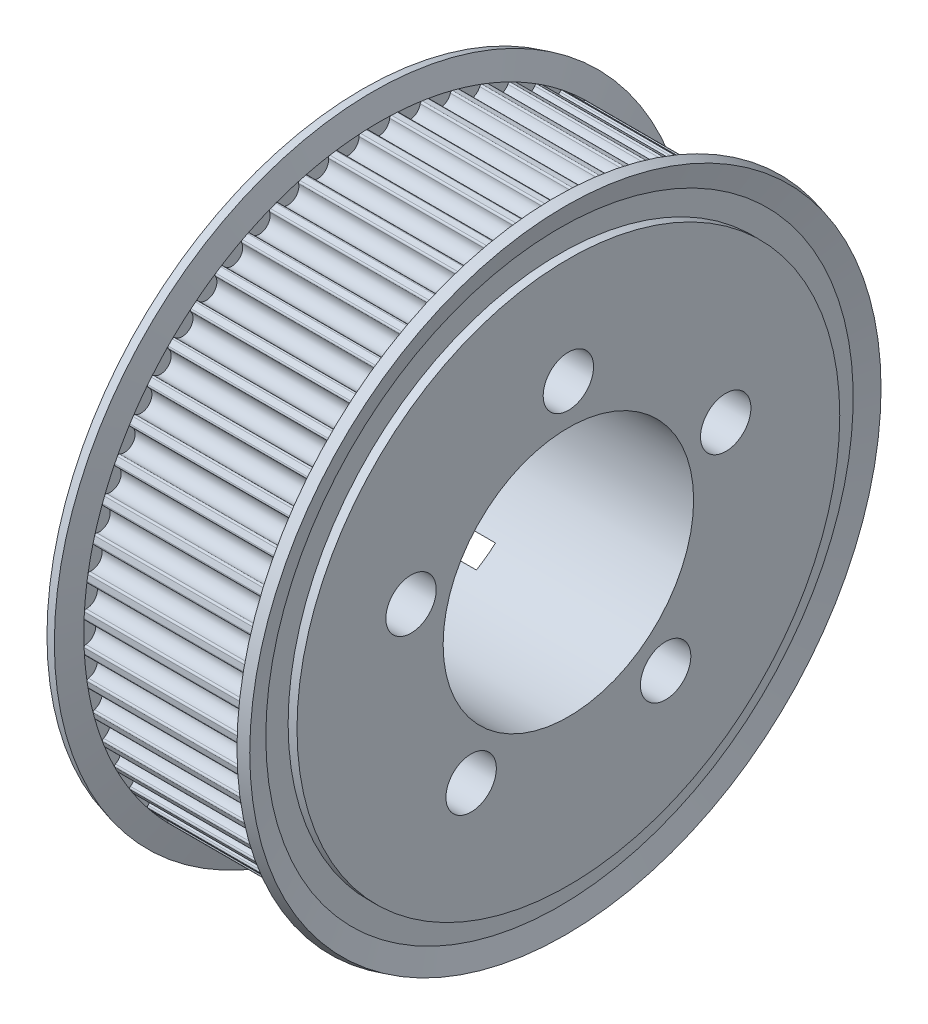
from build123d import *

# Parameters (mm, degrees)
CUT_EXTRUDE1_DEPTH       = 8.15
CUT_EXTRUDE1_DEPTH_BACK  = 8.15
CUT_EXTRUDE2_DEPTH       = 8.15
CUT_EXTRUDE2_DEPTH_BACK  = 8.15
CUT_EXTRUDE3_DEPTH       = 8.15
CUT_EXTRUDE3_DEPTH_BACK  = 8.15
CUT_EXTRUDE4_DEPTH       = 8.15
CUT_EXTRUDE4_DEPTH_BACK  = 8.15
CUT_EXTRUDE5_DEPTH       = 8.15
CUT_EXTRUDE5_DEPTH_BACK  = 8.15
CUT_EXTRUDE6_DEPTH       = 8.15
CUT_EXTRUDE6_DEPTH_BACK  = 8.15
CUT_EXTRUDE7_DEPTH       = 8.15
CUT_EXTRUDE7_DEPTH_BACK  = 8.15
CUT_EXTRUDE8_DEPTH       = 8.15
CUT_EXTRUDE8_DEPTH_BACK  = 8.15
CUT_EXTRUDE9_DEPTH       = 8.15
CUT_EXTRUDE9_DEPTH_BACK  = 8.15
CUT_EXTRUDE10_DEPTH      = 8.15
CUT_EXTRUDE10_DEPTH_BACK = 8.15
CUT_EXTRUDE11_DEPTH      = 8.15
CUT_EXTRUDE11_DEPTH_BACK = 8.15
CUT_EXTRUDE12_DEPTH      = 8.15
CUT_EXTRUDE12_DEPTH_BACK = 8.15
CUT_EXTRUDE13_DEPTH      = 8.15
CUT_EXTRUDE13_DEPTH_BACK = 8.15
CUT_EXTRUDE14_DEPTH      = 8.15
CUT_EXTRUDE14_DEPTH_BACK = 8.15
CUT_EXTRUDE15_DEPTH      = 8.15
CUT_EXTRUDE15_DEPTH_BACK = 8.15
CUT_EXTRUDE16_DEPTH      = 8.15
CUT_EXTRUDE16_DEPTH_BACK = 8.15
CUT_EXTRUDE17_DEPTH      = 8.15
CUT_EXTRUDE17_DEPTH_BACK = 8.15
CUT_EXTRUDE18_DEPTH      = 8.15
CUT_EXTRUDE18_DEPTH_BACK = 8.15
CUT_EXTRUDE19_DEPTH      = 8.15
CUT_EXTRUDE19_DEPTH_BACK = 8.15
CUT_EXTRUDE20_DEPTH      = 8.15
CUT_EXTRUDE20_DEPTH_BACK = 8.15
CUT_EXTRUDE21_DEPTH      = 8.15
CUT_EXTRUDE21_DEPTH_BACK = 8.15
CUT_EXTRUDE22_DEPTH      = 8.15
CUT_EXTRUDE22_DEPTH_BACK = 8.15
CUT_EXTRUDE23_DEPTH      = 8.15
CUT_EXTRUDE23_DEPTH_BACK = 8.15
CUT_EXTRUDE24_DEPTH      = 8.15
CUT_EXTRUDE24_DEPTH_BACK = 8.15
CUT_EXTRUDE25_DEPTH      = 8.15
CUT_EXTRUDE25_DEPTH_BACK = 8.15
CUT_EXTRUDE26_DEPTH      = 8.15
CUT_EXTRUDE26_DEPTH_BACK = 8.15
CUT_EXTRUDE27_DEPTH      = 8.15
CUT_EXTRUDE27_DEPTH_BACK = 8.15
CUT_EXTRUDE28_DEPTH      = 8.15
CUT_EXTRUDE28_DEPTH_BACK = 8.15
CUT_EXTRUDE29_DEPTH      = 8.15
CUT_EXTRUDE29_DEPTH_BACK = 8.15
CUT_EXTRUDE30_DEPTH      = 8.15
CUT_EXTRUDE30_DEPTH_BACK = 8.15
CUT_EXTRUDE31_DEPTH      = 8.15
CUT_EXTRUDE31_DEPTH_BACK = 8.15
CUT_EXTRUDE32_DEPTH      = 8.15
CUT_EXTRUDE32_DEPTH_BACK = 8.15
CUT_EXTRUDE33_DEPTH      = 8.15
CUT_EXTRUDE33_DEPTH_BACK = 8.15
CUT_EXTRUDE34_DEPTH      = 8.15
CUT_EXTRUDE34_DEPTH_BACK = 8.15
CUT_EXTRUDE35_DEPTH      = 8.15
CUT_EXTRUDE35_DEPTH_BACK = 8.15
CUT_EXTRUDE36_DEPTH      = 8.15
CUT_EXTRUDE36_DEPTH_BACK = 8.15
CUT_EXTRUDE37_DEPTH      = 8.15
CUT_EXTRUDE37_DEPTH_BACK = 8.15
CUT_EXTRUDE38_DEPTH      = 8.15
CUT_EXTRUDE38_DEPTH_BACK = 8.15
CUT_EXTRUDE39_DEPTH      = 8.15
CUT_EXTRUDE39_DEPTH_BACK = 8.15
CUT_EXTRUDE40_DEPTH      = 8.15
CUT_EXTRUDE40_DEPTH_BACK = 8.15
CUT_EXTRUDE41_DEPTH      = 8.15
CUT_EXTRUDE41_DEPTH_BACK = 8.15
CUT_EXTRUDE42_DEPTH      = 8.15
CUT_EXTRUDE42_DEPTH_BACK = 8.15
CUT_EXTRUDE43_DEPTH      = 8.15
CUT_EXTRUDE43_DEPTH_BACK = 8.15
CUT_EXTRUDE44_DEPTH      = 8.15
CUT_EXTRUDE44_DEPTH_BACK = 8.15
CUT_EXTRUDE45_DEPTH      = 8.15
CUT_EXTRUDE45_DEPTH_BACK = 8.15
CUT_EXTRUDE46_DEPTH      = 8.15
CUT_EXTRUDE46_DEPTH_BACK = 8.15
CUT_EXTRUDE47_DEPTH      = 8.15
CUT_EXTRUDE47_DEPTH_BACK = 8.15
CUT_EXTRUDE48_DEPTH      = 8.15
CUT_EXTRUDE48_DEPTH_BACK = 8.15
CUT_EXTRUDE49_DEPTH      = 8.15
CUT_EXTRUDE49_DEPTH_BACK = 8.15
CUT_EXTRUDE50_DEPTH      = 8.15
CUT_EXTRUDE50_DEPTH_BACK = 8.15
CUT_EXTRUDE51_DEPTH      = 8.15
CUT_EXTRUDE51_DEPTH_BACK = 8.15
CUT_EXTRUDE52_DEPTH      = 8.15
CUT_EXTRUDE52_DEPTH_BACK = 8.15
CUT_EXTRUDE53_DEPTH      = 8.15
CUT_EXTRUDE53_DEPTH_BACK = 8.15
CUT_EXTRUDE54_DEPTH      = 8.15
CUT_EXTRUDE54_DEPTH_BACK = 8.15
CUT_EXTRUDE55_DEPTH      = 8.15
CUT_EXTRUDE55_DEPTH_BACK = 8.15
CUT_EXTRUDE56_DEPTH      = 8.15
CUT_EXTRUDE56_DEPTH_BACK = 8.15
CUT_EXTRUDE57_DEPTH      = 8.15
CUT_EXTRUDE57_DEPTH_BACK = 8.15
CUT_EXTRUDE58_DEPTH      = 8.15
CUT_EXTRUDE58_DEPTH_BACK = 8.15
CUT_EXTRUDE59_DEPTH      = 8.15
CUT_EXTRUDE59_DEPTH_BACK = 8.15
CUT_EXTRUDE60_DEPTH      = 8.15
CUT_EXTRUDE60_DEPTH_BACK = 8.15
SKETCH62_W               = 20
SKETCH62_H               = 12
SKETCH63_R               = 2.413
CUT_EXTRUDE61_DEPTH      = 48.544715795
SKETCH64_R               = 4.064
CUT_EXTRUDE62_DEPTH      = 5.08


with BuildPart() as part:
    # Sketch1 → Revolve1 (revolve)
    with BuildSketch(Plane.XY, mode=Mode.PRIVATE) as revolve1_sk:
        Polygon((0, 0), (0, 26), (0.85, 26), (0.85, 28.138347502), (0.286547475, 30.241180955), (1.252473301, 30.5), (1.85, 28.27), (18.15, 28.27), (18.747526699, 30.5), (19.713452525, 30.241180955), (19.15, 28.138347502), (19.15, 26), (20, 26), (20, 0), align=None)
    revolve(revolve1_sk.sketch.rotate(Axis((20, 0, 0), (-1, 0, 0)), 270), axis=Axis((20, 0, 0), (-1, 0, 0)))

    # Sketch2 → Cut-Extrude1 (cut, two sides: drawn at the far end of the back side and taken through both)
    with BuildSketch(Plane(origin=(10, 0, 0), x_dir=(0, 0, -1), z_dir=(1, 0, 0)).offset(-CUT_EXTRUDE1_DEPTH_BACK)):
        with BuildLine():
            Line((-1.220377727, 28.623996545), (-1.204191216, 28.244341442))
            ThreePointArc((-1.204191216, 28.244341442), (-1.083780205, 28.201352445), (-1.027381979, 28.086608793))
            ThreePointArc((-1.027381979, 28.086608793), (5e-08, 27.13), (1.027381986, 28.086608894))
            ThreePointArc((1.027381986, 28.086608894), (1.083780242, 28.201352479), (1.204191216, 28.244341442))
            Line((1.204191216, 28.244341442), (1.220377727, 28.623996545))
            ThreePointArc((1.220377727, 28.623996545), (0, 28.65), (-1.220377727, 28.623996545))
        make_face()
    extrude(amount=CUT_EXTRUDE1_DEPTH + CUT_EXTRUDE1_DEPTH_BACK, mode=Mode.SUBTRACT)

    # Sketch3 → Cut-Extrude2 (cut, two sides: drawn at the far end of the back side and taken through both)
    with BuildSketch(Plane(origin=(10, 0, 0), x_dir=(0, 0, -1), z_dir=(1, 0, 0)).offset(-CUT_EXTRUDE2_DEPTH_BACK)):
        with BuildLine():
            Line((-4.205714742, 28.339627088), (-4.149932138, 27.963743727))
            ThreePointArc((-4.149932138, 27.963743727), (-4.025687177, 27.933576607), (-3.957603929, 27.825356752))
            ThreePointArc((-3.957603929, 27.825356752), (-2.835857158, 26.981379027), (-1.914096186, 28.040138172))
            ThreePointArc((-1.914096186, 28.040138172), (-1.870000856, 28.160148403), (-1.754743076, 28.215488242))
            Line((-1.754743076, 28.215488242), (-1.778330001, 28.594755505))
            ThreePointArc((-1.778330001, 28.594755505), (-2.994740473, 28.493052302), (-4.205714742, 28.339627088))
        make_face()
    extrude(amount=CUT_EXTRUDE2_DEPTH + CUT_EXTRUDE2_DEPTH_BACK, mode=Mode.SUBTRACT)

    # Sketch4 → Cut-Extrude3 (cut, two sides: drawn at the far end of the back side and taken through both)
    with BuildSketch(Plane(origin=(10, 0, 0), x_dir=(0, 0, -1), z_dir=(1, 0, 0)).offset(-CUT_EXTRUDE3_DEPTH_BACK)):
        with BuildLine():
            Line((-7.144973065, 27.744762747), (-7.050205534, 27.376769384))
            ThreePointArc((-7.050205534, 27.376769384), (-6.923487877, 27.359754657), (-6.844465541, 27.25924428))
            ThreePointArc((-6.844465541, 27.25924428), (-5.640644123, 26.537144418), (-4.83460312, 27.686453828))
            ThreePointArc((-4.83460312, 27.686453828), (-4.803293833, 27.810415847), (-4.694452036, 27.877500248))
            Line((-4.694452036, 27.877500248), (-4.757553974, 28.252224341))
            ThreePointArc((-4.757553974, 28.252224341), (-5.956669942, 28.023928761), (-7.144973065, 27.744762747))
        make_face()
    extrude(amount=CUT_EXTRUDE3_DEPTH + CUT_EXTRUDE3_DEPTH_BACK, mode=Mode.SUBTRACT)

    # Sketch5 → Cut-Extrude4 (cut, two sides: drawn at the far end of the back side and taken through both)
    with BuildSketch(Plane(origin=(10, 0, 0), x_dir=(0, 0, -1), z_dir=(1, 0, 0)).offset(-CUT_EXTRUDE4_DEPTH_BACK)):
        with BuildLine():
            Line((-10.005949569, 26.845920979), (-9.873235404, 26.489849427))
            ThreePointArc((-9.873235404, 26.489849427), (-9.745433396, 26.48617351), (-9.656337757, 26.394473822))
            ThreePointArc((-9.656337757, 26.394473822), (-8.383631009, 25.802163303), (-7.70214113, 27.029430903))
            ThreePointArc((-7.70214113, 27.029430903), (-7.683960919, 27.155986556), (-7.582727597, 27.234080528))
            Line((-7.582727597, 27.234080528), (-7.68465319, 27.600155894))
            ThreePointArc((-7.68465319, 27.600155894), (-8.853336889, 27.247769192), (-10.005949569, 26.845920979))
        make_face()
    extrude(amount=CUT_EXTRUDE4_DEPTH + CUT_EXTRUDE4_DEPTH_BACK, mode=Mode.SUBTRACT)

    # Sketch6 → Cut-Extrude5 (cut, two sides: drawn at the far end of the back side and taken through both)
    with BuildSketch(Plane(origin=(10, 0, 0), x_dir=(0, 0, -1), z_dir=(1, 0, 0)).offset(-CUT_EXTRUDE5_DEPTH_BACK)):
        with BuildLine():
            Line((-12.757298795, 25.652949683), (-12.58809204, 25.312701136))
            ThreePointArc((-12.58809204, 25.312701136), (-12.460605907, 25.322404304), (-12.362413116, 25.240519986))
            ThreePointArc((-12.362413116, 25.240519986), (-11.034765081, 24.784488286), (-10.48529287, 26.076267876))
            ThreePointArc((-10.48529287, 26.076267876), (-10.48044092, 26.204030594), (-10.387925208, 26.292278522))
            Line((-10.387925208, 26.292278522), (-10.527557737, 26.645694363))
            ThreePointArc((-10.527557737, 26.645694363), (-11.653004824, 26.173077361), (-12.757298795, 25.652949683))
        make_face()
    extrude(amount=CUT_EXTRUDE5_DEPTH + CUT_EXTRUDE5_DEPTH_BACK, mode=Mode.SUBTRACT)

    # Sketch7 → Cut-Extrude6 (cut, two sides: drawn at the far end of the back side and taken through both)
    with BuildSketch(Plane(origin=(10, 0, 0), x_dir=(0, 0, -1), z_dir=(1, 0, 0)).offset(-CUT_EXTRUDE6_DEPTH_BACK)):
        with BuildLine():
            Line((-15.368876386, 24.178919302), (-15.165030906, 23.858221594))
            ThreePointArc((-15.165030906, 23.858221594), (-15.039257412, 23.881197536), (-14.93304329, 23.810025732))
            ThreePointArc((-14.93304329, 23.810025732), (-13.564999956, 23.49526923), (-13.153565547, 24.837407801))
            ThreePointArc((-13.153565547, 24.837407801), (-13.162095017, 24.964977789), (-13.079310537, 25.06241281))
            Line((-13.079310537, 25.06241281), (-13.255120158, 25.399297029))
            ThreePointArc((-13.255120158, 25.399297029), (-14.325, 24.811627818), (-15.368876386, 24.178919302))
        make_face()
    extrude(amount=CUT_EXTRUDE6_DEPTH + CUT_EXTRUDE6_DEPTH_BACK, mode=Mode.SUBTRACT)

    # Sketch8 → Cut-Extrude7 (cut, two sides: drawn at the far end of the back side and taken through both)
    with BuildSketch(Plane(origin=(10, 0, 0), x_dir=(0, 0, -1), z_dir=(1, 0, 0)).offset(-CUT_EXTRUDE7_DEPTH_BACK)):
        with BuildLine():
            Line((-17.812069352, 22.439979621), (-17.575818519, 22.142346384))
            ThreePointArc((-17.575818519, 22.142346384), (-17.453135666, 22.178343372), (-17.340063916, 22.118663852))
            ThreePointArc((-17.340063916, 22.118663852), (-15.946613854, 21.948631087), (-15.677725008, 23.326423889))
            ThreePointArc((-15.677725008, 23.326423889), (-15.699542448, 23.452403463), (-15.627396202, 23.55795806))
            Line((-15.627396202, 23.55795806), (-15.83745671, 23.874619682))
            ThreePointArc((-15.83745671, 23.874619682), (-16.840047478, 23.178336889), (-17.812069352, 22.439979621))
        make_face()
    extrude(amount=CUT_EXTRUDE7_DEPTH + CUT_EXTRUDE7_DEPTH_BACK, mode=Mode.SUBTRACT)

    # Sketch9 → Cut-Extrude8 (cut, two sides: drawn at the far end of the back side and taken through both)
    with BuildSketch(Plane(origin=(10, 0, 0), x_dir=(0, 0, -1), z_dir=(1, 0, 0)).offset(-CUT_EXTRUDE8_DEPTH_BACK)):
        with BuildLine():
            Line((-20.060109558, 20.455182828), (-19.794041787, 20.183874993))
            ThreePointArc((-19.794041787, 20.183874993), (-19.675793713, 20.232498636), (-19.557103174, 20.184965263))
            ThreePointArc((-19.557103174, 20.184965263), (-18.153513313, 20.161519149), (-18.030116033, 21.559870796))
            ThreePointArc((-18.030116033, 21.559870796), (-18.064982405, 21.682879697), (-18.004264844, 21.795397391))
            Line((-18.004264844, 21.795397391), (-18.246274771, 22.088367005))
            ThreePointArc((-18.246274771, 22.088367005), (-19.170591872, 21.29109925), (-20.060109558, 20.455182828))
        make_face()
    extrude(amount=CUT_EXTRUDE8_DEPTH + CUT_EXTRUDE8_DEPTH_BACK, mode=Mode.SUBTRACT)

    # Sketch10 → Cut-Extrude9 (cut, two sides: drawn at the far end of the back side and taken through both)
    with BuildSketch(Plane(origin=(10, 0, 0), x_dir=(0, 0, -1), z_dir=(1, 0, 0)).offset(-CUT_EXTRUDE9_DEPTH_BACK)):
        with BuildLine():
            Line((-22.088367005, 18.246274771), (-21.795397391, 18.004264844))
            ThreePointArc((-21.795397391, 18.004264844), (-21.682879647, 18.064982411), (-21.559870717, 18.030115971))
            ThreePointArc((-21.559870717, 18.030115971), (-20.161519081, 18.153513388), (-20.184965333, 19.557103247))
            ThreePointArc((-20.184965333, 19.557103247), (-20.232498635, 19.675793763), (-20.183874993, 19.794041787))
            Line((-20.183874993, 19.794041787), (-20.455182828, 20.060109558))
            ThreePointArc((-20.455182828, 20.060109558), (-21.29109925, 19.170591872), (-22.088367005, 18.246274771))
        make_face()
    extrude(amount=CUT_EXTRUDE9_DEPTH + CUT_EXTRUDE9_DEPTH_BACK, mode=Mode.SUBTRACT)

    # Sketch11 → Cut-Extrude10 (cut, two sides: drawn at the far end of the back side and taken through both)
    with BuildSketch(Plane(origin=(10, 0, 0), x_dir=(0, 0, -1), z_dir=(1, 0, 0)).offset(-CUT_EXTRUDE10_DEPTH_BACK)):
        with BuildLine():
            Line((-23.874619682, 15.83745671), (-23.55795806, 15.627396202))
            ThreePointArc((-23.55795806, 15.627396202), (-23.452403414, 15.699542458), (-23.326423804, 15.677724955))
            ThreePointArc((-23.326423804, 15.677724955), (-21.948631028, 15.946613935), (-22.11866393, 17.340063981))
            ThreePointArc((-22.11866393, 17.340063981), (-22.178343377, 17.453135716), (-22.142346384, 17.575818519))
            Line((-22.142346384, 17.575818519), (-22.439979621, 17.812069352))
            ThreePointArc((-22.439979621, 17.812069352), (-23.178336889, 16.840047478), (-23.874619682, 15.83745671))
        make_face()
    extrude(amount=CUT_EXTRUDE10_DEPTH + CUT_EXTRUDE10_DEPTH_BACK, mode=Mode.SUBTRACT)

    # Sketch12 → Cut-Extrude11 (cut, two sides: drawn at the far end of the back side and taken through both)
    with BuildSketch(Plane(origin=(10, 0, 0), x_dir=(0, 0, -1), z_dir=(1, 0, 0)).offset(-CUT_EXTRUDE11_DEPTH_BACK)):
        with BuildLine():
            Line((-25.399297029, 13.255120158), (-25.06241281, 13.079310537))
            ThreePointArc((-25.06241281, 13.079310537), (-24.964977741, 13.162095033), (-24.837407711, 13.153565503))
            ThreePointArc((-24.837407711, 13.153565503), (-23.495269179, 13.565000044), (-23.810025815, 14.933043346))
            ThreePointArc((-23.810025815, 14.933043346), (-23.881197547, 15.039257461), (-23.858221594, 15.165030906))
            Line((-23.858221594, 15.165030906), (-24.178919302, 15.368876386))
            ThreePointArc((-24.178919302, 15.368876386), (-24.811627818, 14.325), (-25.399297029, 13.255120158))
        make_face()
    extrude(amount=CUT_EXTRUDE11_DEPTH + CUT_EXTRUDE11_DEPTH_BACK, mode=Mode.SUBTRACT)

    # Sketch13 → Cut-Extrude12 (cut, two sides: drawn at the far end of the back side and taken through both)
    with BuildSketch(Plane(origin=(10, 0, 0), x_dir=(0, 0, -1), z_dir=(1, 0, 0)).offset(-CUT_EXTRUDE12_DEPTH_BACK)):
        with BuildLine():
            Line((-26.645694363, 10.527557737), (-26.292278522, 10.387925208))
            ThreePointArc((-26.292278522, 10.387925208), (-26.204030548, 10.480440941), (-26.076267781, 10.485292836))
            ThreePointArc((-26.076267781, 10.485292836), (-24.784488245, 11.034765173), (-25.240520075, 12.362413164))
            ThreePointArc((-25.240520075, 12.362413164), (-25.322404319, 12.460605955), (-25.312701136, 12.58809204))
            Line((-25.312701136, 12.58809204), (-25.652949683, 12.757298795))
            ThreePointArc((-25.652949683, 12.757298795), (-26.173077361, 11.653004824), (-26.645694363, 10.527557737))
        make_face()
    extrude(amount=CUT_EXTRUDE12_DEPTH + CUT_EXTRUDE12_DEPTH_BACK, mode=Mode.SUBTRACT)

    # Sketch14 → Cut-Extrude13 (cut, two sides: drawn at the far end of the back side and taken through both)
    with BuildSketch(Plane(origin=(10, 0, 0), x_dir=(0, 0, -1), z_dir=(1, 0, 0)).offset(-CUT_EXTRUDE13_DEPTH_BACK)):
        with BuildLine():
            Line((-27.600155894, 7.68465319), (-27.234080528, 7.582727597))
            ThreePointArc((-27.234080528, 7.582727597), (-27.155986513, 7.683960944), (-27.029430805, 7.702141106))
            ThreePointArc((-27.029430805, 7.702141106), (-25.802163272, 8.383631105), (-26.394473916, 9.656337795))
            ThreePointArc((-26.394473916, 9.656337795), (-26.48617353, 9.745433442), (-26.489849427, 9.873235404))
            Line((-26.489849427, 9.873235404), (-26.845920979, 10.005949569))
            ThreePointArc((-26.845920979, 10.005949569), (-27.247769192, 8.853336889), (-27.600155894, 7.68465319))
        make_face()
    extrude(amount=CUT_EXTRUDE13_DEPTH + CUT_EXTRUDE13_DEPTH_BACK, mode=Mode.SUBTRACT)

    # Sketch15 → Cut-Extrude14 (cut, two sides: drawn at the far end of the back side and taken through both)
    with BuildSketch(Plane(origin=(10, 0, 0), x_dir=(0, 0, -1), z_dir=(1, 0, 0)).offset(-CUT_EXTRUDE14_DEPTH_BACK)):
        with BuildLine():
            Line((-28.252224341, 4.757553974), (-27.877500248, 4.694452036))
            ThreePointArc((-27.877500248, 4.694452036), (-27.810415807, 4.803293863), (-27.686453728, 4.834603106))
            ThreePointArc((-27.686453728, 4.834603106), (-26.537144397, 5.640644221), (-27.259244376, 6.844465569))
            ThreePointArc((-27.259244376, 6.844465569), (-27.359754682, 6.923487921), (-27.376769384, 7.050205534))
            Line((-27.376769384, 7.050205534), (-27.744762747, 7.144973065))
            ThreePointArc((-27.744762747, 7.144973065), (-28.023928761, 5.956669942), (-28.252224341, 4.757553974))
        make_face()
    extrude(amount=CUT_EXTRUDE14_DEPTH + CUT_EXTRUDE14_DEPTH_BACK, mode=Mode.SUBTRACT)

    # Sketch16 → Cut-Extrude15 (cut, two sides: drawn at the far end of the back side and taken through both)
    with BuildSketch(Plane(origin=(10, 0, 0), x_dir=(0, 0, -1), z_dir=(1, 0, 0)).offset(-CUT_EXTRUDE15_DEPTH_BACK)):
        with BuildLine():
            Line((-28.594755505, 1.778330001), (-28.215488242, 1.754743076))
            ThreePointArc((-28.215488242, 1.754743076), (-28.160148365, 1.87000089), (-28.040138071, 1.914096183))
            ThreePointArc((-28.040138071, 1.914096183), (-26.981379016, 2.835857259), (-27.825356851, 3.957603946))
            ThreePointArc((-27.825356851, 3.957603946), (-27.933576636, 4.025687218), (-27.963743727, 4.149932138))
            Line((-27.963743727, 4.149932138), (-28.339627088, 4.205714742))
            ThreePointArc((-28.339627088, 4.205714742), (-28.493052302, 2.994740473), (-28.594755505, 1.778330001))
        make_face()
    extrude(amount=CUT_EXTRUDE15_DEPTH + CUT_EXTRUDE15_DEPTH_BACK, mode=Mode.SUBTRACT)

    # Sketch17 → Cut-Extrude16 (cut, two sides: drawn at the far end of the back side and taken through both)
    with BuildSketch(Plane(origin=(10, 0, 0), x_dir=(0, 0, -1), z_dir=(1, 0, 0)).offset(-CUT_EXTRUDE16_DEPTH_BACK)):
        with BuildLine():
            Line((-28.623996545, -1.220377727), (-28.244341442, -1.204191216))
            ThreePointArc((-28.244341442, -1.204191216), (-28.201352445, -1.083780205), (-28.086608793, -1.027381979))
            ThreePointArc((-28.086608793, -1.027381979), (-27.13, 5e-08), (-28.086608894, 1.027381986))
            ThreePointArc((-28.086608894, 1.027381986), (-28.201352479, 1.083780242), (-28.244341442, 1.204191216))
            Line((-28.244341442, 1.204191216), (-28.623996545, 1.220377727))
            ThreePointArc((-28.623996545, 1.220377727), (-28.65, 0), (-28.623996545, -1.220377727))
        make_face()
    extrude(amount=CUT_EXTRUDE16_DEPTH + CUT_EXTRUDE16_DEPTH_BACK, mode=Mode.SUBTRACT)

    # Sketch18 → Cut-Extrude17 (cut, two sides: drawn at the far end of the back side and taken through both)
    with BuildSketch(Plane(origin=(10, 0, 0), x_dir=(0, 0, -1), z_dir=(1, 0, 0)).offset(-CUT_EXTRUDE17_DEPTH_BACK)):
        with BuildLine():
            Line((-28.339627088, -4.205714742), (-27.963743727, -4.149932138))
            ThreePointArc((-27.963743727, -4.149932138), (-27.933576607, -4.025687177), (-27.825356752, -3.957603929))
            ThreePointArc((-27.825356752, -3.957603929), (-26.981379027, -2.835857158), (-28.040138172, -1.914096186))
            ThreePointArc((-28.040138172, -1.914096186), (-28.160148403, -1.870000856), (-28.215488242, -1.754743076))
            Line((-28.215488242, -1.754743076), (-28.594755505, -1.778330001))
            ThreePointArc((-28.594755505, -1.778330001), (-28.493052302, -2.994740473), (-28.339627088, -4.205714742))
        make_face()
    extrude(amount=CUT_EXTRUDE17_DEPTH + CUT_EXTRUDE17_DEPTH_BACK, mode=Mode.SUBTRACT)

    # Sketch19 → Cut-Extrude18 (cut, two sides: drawn at the far end of the back side and taken through both)
    with BuildSketch(Plane(origin=(10, 0, 0), x_dir=(0, 0, -1), z_dir=(1, 0, 0)).offset(-CUT_EXTRUDE18_DEPTH_BACK)):
        with BuildLine():
            Line((-27.744762747, -7.144973065), (-27.376769384, -7.050205534))
            ThreePointArc((-27.376769384, -7.050205534), (-27.359754657, -6.923487877), (-27.25924428, -6.844465541))
            ThreePointArc((-27.25924428, -6.844465541), (-26.537144418, -5.640644123), (-27.686453828, -4.83460312))
            ThreePointArc((-27.686453828, -4.83460312), (-27.810415847, -4.803293833), (-27.877500248, -4.694452036))
            Line((-27.877500248, -4.694452036), (-28.252224341, -4.757553974))
            ThreePointArc((-28.252224341, -4.757553974), (-28.023928761, -5.956669942), (-27.744762747, -7.144973065))
        make_face()
    extrude(amount=CUT_EXTRUDE18_DEPTH + CUT_EXTRUDE18_DEPTH_BACK, mode=Mode.SUBTRACT)

    # Sketch20 → Cut-Extrude19 (cut, two sides: drawn at the far end of the back side and taken through both)
    with BuildSketch(Plane(origin=(10, 0, 0), x_dir=(0, 0, -1), z_dir=(1, 0, 0)).offset(-CUT_EXTRUDE19_DEPTH_BACK)):
        with BuildLine():
            Line((-26.845920979, -10.005949569), (-26.489849427, -9.873235404))
            ThreePointArc((-26.489849427, -9.873235404), (-26.48617351, -9.745433396), (-26.394473822, -9.656337757))
            ThreePointArc((-26.394473822, -9.656337757), (-25.802163303, -8.383631009), (-27.029430903, -7.70214113))
            ThreePointArc((-27.029430903, -7.70214113), (-27.155986556, -7.683960919), (-27.234080528, -7.582727597))
            Line((-27.234080528, -7.582727597), (-27.600155894, -7.68465319))
            ThreePointArc((-27.600155894, -7.68465319), (-27.247769192, -8.853336889), (-26.845920979, -10.005949569))
        make_face()
    extrude(amount=CUT_EXTRUDE19_DEPTH + CUT_EXTRUDE19_DEPTH_BACK, mode=Mode.SUBTRACT)

    # Sketch21 → Cut-Extrude20 (cut, two sides: drawn at the far end of the back side and taken through both)
    with BuildSketch(Plane(origin=(10, 0, 0), x_dir=(0, 0, -1), z_dir=(1, 0, 0)).offset(-CUT_EXTRUDE20_DEPTH_BACK)):
        with BuildLine():
            Line((-25.652949683, -12.757298795), (-25.312701136, -12.58809204))
            ThreePointArc((-25.312701136, -12.58809204), (-25.322404304, -12.460605907), (-25.240519986, -12.362413116))
            ThreePointArc((-25.240519986, -12.362413116), (-24.784488286, -11.034765081), (-26.076267876, -10.48529287))
            ThreePointArc((-26.076267876, -10.48529287), (-26.204030594, -10.48044092), (-26.292278522, -10.387925208))
            Line((-26.292278522, -10.387925208), (-26.645694363, -10.527557737))
            ThreePointArc((-26.645694363, -10.527557737), (-26.173077361, -11.653004824), (-25.652949683, -12.757298795))
        make_face()
    extrude(amount=CUT_EXTRUDE20_DEPTH + CUT_EXTRUDE20_DEPTH_BACK, mode=Mode.SUBTRACT)

    # Sketch22 → Cut-Extrude21 (cut, two sides: drawn at the far end of the back side and taken through both)
    with BuildSketch(Plane(origin=(10, 0, 0), x_dir=(0, 0, -1), z_dir=(1, 0, 0)).offset(-CUT_EXTRUDE21_DEPTH_BACK)):
        with BuildLine():
            Line((-24.178919302, -15.368876386), (-23.858221594, -15.165030906))
            ThreePointArc((-23.858221594, -15.165030906), (-23.881197536, -15.039257412), (-23.810025732, -14.93304329))
            ThreePointArc((-23.810025732, -14.93304329), (-23.49526923, -13.564999956), (-24.837407801, -13.153565547))
            ThreePointArc((-24.837407801, -13.153565547), (-24.964977789, -13.162095017), (-25.06241281, -13.079310537))
            Line((-25.06241281, -13.079310537), (-25.399297029, -13.255120158))
            ThreePointArc((-25.399297029, -13.255120158), (-24.811627818, -14.325), (-24.178919302, -15.368876386))
        make_face()
    extrude(amount=CUT_EXTRUDE21_DEPTH + CUT_EXTRUDE21_DEPTH_BACK, mode=Mode.SUBTRACT)

    # Sketch23 → Cut-Extrude22 (cut, two sides: drawn at the far end of the back side and taken through both)
    with BuildSketch(Plane(origin=(10, 0, 0), x_dir=(0, 0, -1), z_dir=(1, 0, 0)).offset(-CUT_EXTRUDE22_DEPTH_BACK)):
        with BuildLine():
            Line((-22.439979621, -17.812069352), (-22.142346384, -17.575818519))
            ThreePointArc((-22.142346384, -17.575818519), (-22.178343372, -17.453135666), (-22.118663852, -17.340063916))
            ThreePointArc((-22.118663852, -17.340063916), (-21.948631087, -15.946613854), (-23.326423889, -15.677725008))
            ThreePointArc((-23.326423889, -15.677725008), (-23.452403463, -15.699542448), (-23.55795806, -15.627396202))
            Line((-23.55795806, -15.627396202), (-23.874619682, -15.83745671))
            ThreePointArc((-23.874619682, -15.83745671), (-23.178336889, -16.840047478), (-22.439979621, -17.812069352))
        make_face()
    extrude(amount=CUT_EXTRUDE22_DEPTH + CUT_EXTRUDE22_DEPTH_BACK, mode=Mode.SUBTRACT)

    # Sketch24 → Cut-Extrude23 (cut, two sides: drawn at the far end of the back side and taken through both)
    with BuildSketch(Plane(origin=(10, 0, 0), x_dir=(0, 0, -1), z_dir=(1, 0, 0)).offset(-CUT_EXTRUDE23_DEPTH_BACK)):
        with BuildLine():
            Line((-20.455182828, -20.060109558), (-20.183874993, -19.794041787))
            ThreePointArc((-20.183874993, -19.794041787), (-20.232498636, -19.675793713), (-20.184965263, -19.557103174))
            ThreePointArc((-20.184965263, -19.557103174), (-20.161519149, -18.153513313), (-21.559870796, -18.030116033))
            ThreePointArc((-21.559870796, -18.030116033), (-21.682879697, -18.064982405), (-21.795397391, -18.004264844))
            Line((-21.795397391, -18.004264844), (-22.088367005, -18.246274771))
            ThreePointArc((-22.088367005, -18.246274771), (-21.29109925, -19.170591872), (-20.455182828, -20.060109558))
        make_face()
    extrude(amount=CUT_EXTRUDE23_DEPTH + CUT_EXTRUDE23_DEPTH_BACK, mode=Mode.SUBTRACT)

    # Sketch25 → Cut-Extrude24 (cut, two sides: drawn at the far end of the back side and taken through both)
    with BuildSketch(Plane(origin=(10, 0, 0), x_dir=(0, 0, -1), z_dir=(1, 0, 0)).offset(-CUT_EXTRUDE24_DEPTH_BACK)):
        with BuildLine():
            Line((-18.246274771, -22.088367005), (-18.004264844, -21.795397391))
            ThreePointArc((-18.004264844, -21.795397391), (-18.064982411, -21.682879647), (-18.030115971, -21.559870717))
            ThreePointArc((-18.030115971, -21.559870717), (-18.153513388, -20.161519081), (-19.557103247, -20.184965333))
            ThreePointArc((-19.557103247, -20.184965333), (-19.675793763, -20.232498635), (-19.794041787, -20.183874993))
            Line((-19.794041787, -20.183874993), (-20.060109558, -20.455182828))
            ThreePointArc((-20.060109558, -20.455182828), (-19.170591872, -21.29109925), (-18.246274771, -22.088367005))
        make_face()
    extrude(amount=CUT_EXTRUDE24_DEPTH + CUT_EXTRUDE24_DEPTH_BACK, mode=Mode.SUBTRACT)

    # Sketch26 → Cut-Extrude25 (cut, two sides: drawn at the far end of the back side and taken through both)
    with BuildSketch(Plane(origin=(10, 0, 0), x_dir=(0, 0, -1), z_dir=(1, 0, 0)).offset(-CUT_EXTRUDE25_DEPTH_BACK)):
        with BuildLine():
            Line((-15.83745671, -23.874619682), (-15.627396202, -23.55795806))
            ThreePointArc((-15.627396202, -23.55795806), (-15.699542458, -23.452403414), (-15.677724955, -23.326423804))
            ThreePointArc((-15.677724955, -23.326423804), (-15.946613935, -21.948631028), (-17.340063981, -22.11866393))
            ThreePointArc((-17.340063981, -22.11866393), (-17.453135716, -22.178343377), (-17.575818519, -22.142346384))
            Line((-17.575818519, -22.142346384), (-17.812069352, -22.439979621))
            ThreePointArc((-17.812069352, -22.439979621), (-16.840047478, -23.178336889), (-15.83745671, -23.874619682))
        make_face()
    extrude(amount=CUT_EXTRUDE25_DEPTH + CUT_EXTRUDE25_DEPTH_BACK, mode=Mode.SUBTRACT)

    # Sketch27 → Cut-Extrude26 (cut, two sides: drawn at the far end of the back side and taken through both)
    with BuildSketch(Plane(origin=(10, 0, 0), x_dir=(0, 0, -1), z_dir=(1, 0, 0)).offset(-CUT_EXTRUDE26_DEPTH_BACK)):
        with BuildLine():
            Line((-13.255120158, -25.399297029), (-13.079310537, -25.06241281))
            ThreePointArc((-13.079310537, -25.06241281), (-13.162095033, -24.964977741), (-13.153565503, -24.837407711))
            ThreePointArc((-13.153565503, -24.837407711), (-13.565000044, -23.495269179), (-14.933043346, -23.810025815))
            ThreePointArc((-14.933043346, -23.810025815), (-15.039257461, -23.881197547), (-15.165030906, -23.858221594))
            Line((-15.165030906, -23.858221594), (-15.368876386, -24.178919302))
            ThreePointArc((-15.368876386, -24.178919302), (-14.325, -24.811627818), (-13.255120158, -25.399297029))
        make_face()
    extrude(amount=CUT_EXTRUDE26_DEPTH + CUT_EXTRUDE26_DEPTH_BACK, mode=Mode.SUBTRACT)

    # Sketch28 → Cut-Extrude27 (cut, two sides: drawn at the far end of the back side and taken through both)
    with BuildSketch(Plane(origin=(10, 0, 0), x_dir=(0, 0, -1), z_dir=(1, 0, 0)).offset(-CUT_EXTRUDE27_DEPTH_BACK)):
        with BuildLine():
            Line((-10.527557737, -26.645694363), (-10.387925208, -26.292278522))
            ThreePointArc((-10.387925208, -26.292278522), (-10.480440941, -26.204030548), (-10.485292836, -26.076267781))
            ThreePointArc((-10.485292836, -26.076267781), (-11.034765173, -24.784488245), (-12.362413164, -25.240520075))
            ThreePointArc((-12.362413164, -25.240520075), (-12.460605955, -25.322404319), (-12.58809204, -25.312701136))
            Line((-12.58809204, -25.312701136), (-12.757298795, -25.652949683))
            ThreePointArc((-12.757298795, -25.652949683), (-11.653004824, -26.173077361), (-10.527557737, -26.645694363))
        make_face()
    extrude(amount=CUT_EXTRUDE27_DEPTH + CUT_EXTRUDE27_DEPTH_BACK, mode=Mode.SUBTRACT)

    # Sketch29 → Cut-Extrude28 (cut, two sides: drawn at the far end of the back side and taken through both)
    with BuildSketch(Plane(origin=(10, 0, 0), x_dir=(0, 0, -1), z_dir=(1, 0, 0)).offset(-CUT_EXTRUDE28_DEPTH_BACK)):
        with BuildLine():
            Line((-7.68465319, -27.600155894), (-7.582727597, -27.234080528))
            ThreePointArc((-7.582727597, -27.234080528), (-7.683960944, -27.155986513), (-7.702141106, -27.029430805))
            ThreePointArc((-7.702141106, -27.029430805), (-8.383631105, -25.802163272), (-9.656337795, -26.394473916))
            ThreePointArc((-9.656337795, -26.394473916), (-9.745433442, -26.48617353), (-9.873235404, -26.489849427))
            Line((-9.873235404, -26.489849427), (-10.005949569, -26.845920979))
            ThreePointArc((-10.005949569, -26.845920979), (-8.853336889, -27.247769192), (-7.68465319, -27.600155894))
        make_face()
    extrude(amount=CUT_EXTRUDE28_DEPTH + CUT_EXTRUDE28_DEPTH_BACK, mode=Mode.SUBTRACT)

    # Sketch30 → Cut-Extrude29 (cut, two sides: drawn at the far end of the back side and taken through both)
    with BuildSketch(Plane(origin=(10, 0, 0), x_dir=(0, 0, -1), z_dir=(1, 0, 0)).offset(-CUT_EXTRUDE29_DEPTH_BACK)):
        with BuildLine():
            Line((-4.757553974, -28.252224341), (-4.694452036, -27.877500248))
            ThreePointArc((-4.694452036, -27.877500248), (-4.803293863, -27.810415807), (-4.834603106, -27.686453728))
            ThreePointArc((-4.834603106, -27.686453728), (-5.640644221, -26.537144397), (-6.844465569, -27.259244376))
            ThreePointArc((-6.844465569, -27.259244376), (-6.923487921, -27.359754682), (-7.050205534, -27.376769384))
            Line((-7.050205534, -27.376769384), (-7.144973065, -27.744762747))
            ThreePointArc((-7.144973065, -27.744762747), (-5.956669942, -28.023928761), (-4.757553974, -28.252224341))
        make_face()
    extrude(amount=CUT_EXTRUDE29_DEPTH + CUT_EXTRUDE29_DEPTH_BACK, mode=Mode.SUBTRACT)

    # Sketch31 → Cut-Extrude30 (cut, two sides: drawn at the far end of the back side and taken through both)
    with BuildSketch(Plane(origin=(10, 0, 0), x_dir=(0, 0, -1), z_dir=(1, 0, 0)).offset(-CUT_EXTRUDE30_DEPTH_BACK)):
        with BuildLine():
            Line((-1.778330001, -28.594755505), (-1.754743076, -28.215488242))
            ThreePointArc((-1.754743076, -28.215488242), (-1.87000089, -28.160148365), (-1.914096183, -28.040138071))
            ThreePointArc((-1.914096183, -28.040138071), (-2.835857259, -26.981379016), (-3.957603946, -27.825356851))
            ThreePointArc((-3.957603946, -27.825356851), (-4.025687218, -27.933576636), (-4.149932138, -27.963743727))
            Line((-4.149932138, -27.963743727), (-4.205714742, -28.339627088))
            ThreePointArc((-4.205714742, -28.339627088), (-2.994740473, -28.493052302), (-1.778330001, -28.594755505))
        make_face()
    extrude(amount=CUT_EXTRUDE30_DEPTH + CUT_EXTRUDE30_DEPTH_BACK, mode=Mode.SUBTRACT)

    # Sketch32 → Cut-Extrude31 (cut, two sides: drawn at the far end of the back side and taken through both)
    with BuildSketch(Plane(origin=(10, 0, 0), x_dir=(0, 0, -1), z_dir=(1, 0, 0)).offset(-CUT_EXTRUDE31_DEPTH_BACK)):
        with BuildLine():
            Line((1.220377727, -28.623996545), (1.204191216, -28.244341442))
            ThreePointArc((1.204191216, -28.244341442), (1.083780205, -28.201352445), (1.027381979, -28.086608793))
            ThreePointArc((1.027381979, -28.086608793), (-5e-08, -27.13), (-1.027381986, -28.086608894))
            ThreePointArc((-1.027381986, -28.086608894), (-1.083780242, -28.201352479), (-1.204191216, -28.244341442))
            Line((-1.204191216, -28.244341442), (-1.220377727, -28.623996545))
            ThreePointArc((-1.220377727, -28.623996545), (0, -28.65), (1.220377727, -28.623996545))
        make_face()
    extrude(amount=CUT_EXTRUDE31_DEPTH + CUT_EXTRUDE31_DEPTH_BACK, mode=Mode.SUBTRACT)

    # Sketch33 → Cut-Extrude32 (cut, two sides: drawn at the far end of the back side and taken through both)
    with BuildSketch(Plane(origin=(10, 0, 0), x_dir=(0, 0, -1), z_dir=(1, 0, 0)).offset(-CUT_EXTRUDE32_DEPTH_BACK)):
        with BuildLine():
            Line((4.205714742, -28.339627088), (4.149932138, -27.963743727))
            ThreePointArc((4.149932138, -27.963743727), (4.025687177, -27.933576607), (3.957603929, -27.825356752))
            ThreePointArc((3.957603929, -27.825356752), (2.835857158, -26.981379027), (1.914096186, -28.040138172))
            ThreePointArc((1.914096186, -28.040138172), (1.870000856, -28.160148403), (1.754743076, -28.215488242))
            Line((1.754743076, -28.215488242), (1.778330001, -28.594755505))
            ThreePointArc((1.778330001, -28.594755505), (2.994740473, -28.493052302), (4.205714742, -28.339627088))
        make_face()
    extrude(amount=CUT_EXTRUDE32_DEPTH + CUT_EXTRUDE32_DEPTH_BACK, mode=Mode.SUBTRACT)

    # Sketch34 → Cut-Extrude33 (cut, two sides: drawn at the far end of the back side and taken through both)
    with BuildSketch(Plane(origin=(10, 0, 0), x_dir=(0, 0, -1), z_dir=(1, 0, 0)).offset(-CUT_EXTRUDE33_DEPTH_BACK)):
        with BuildLine():
            Line((7.144973065, -27.744762747), (7.050205534, -27.376769384))
            ThreePointArc((7.050205534, -27.376769384), (6.923487877, -27.359754657), (6.844465541, -27.25924428))
            ThreePointArc((6.844465541, -27.25924428), (5.640644123, -26.537144418), (4.83460312, -27.686453828))
            ThreePointArc((4.83460312, -27.686453828), (4.803293833, -27.810415847), (4.694452036, -27.877500248))
            Line((4.694452036, -27.877500248), (4.757553974, -28.252224341))
            ThreePointArc((4.757553974, -28.252224341), (5.956669942, -28.023928761), (7.144973065, -27.744762747))
        make_face()
    extrude(amount=CUT_EXTRUDE33_DEPTH + CUT_EXTRUDE33_DEPTH_BACK, mode=Mode.SUBTRACT)

    # Sketch35 → Cut-Extrude34 (cut, two sides: drawn at the far end of the back side and taken through both)
    with BuildSketch(Plane(origin=(10, 0, 0), x_dir=(0, 0, -1), z_dir=(1, 0, 0)).offset(-CUT_EXTRUDE34_DEPTH_BACK)):
        with BuildLine():
            Line((10.005949569, -26.845920979), (9.873235404, -26.489849427))
            ThreePointArc((9.873235404, -26.489849427), (9.745433396, -26.48617351), (9.656337757, -26.394473822))
            ThreePointArc((9.656337757, -26.394473822), (8.383631009, -25.802163303), (7.70214113, -27.029430903))
            ThreePointArc((7.70214113, -27.029430903), (7.683960919, -27.155986556), (7.582727597, -27.234080528))
            Line((7.582727597, -27.234080528), (7.68465319, -27.600155894))
            ThreePointArc((7.68465319, -27.600155894), (8.853336889, -27.247769192), (10.005949569, -26.845920979))
        make_face()
    extrude(amount=CUT_EXTRUDE34_DEPTH + CUT_EXTRUDE34_DEPTH_BACK, mode=Mode.SUBTRACT)

    # Sketch36 → Cut-Extrude35 (cut, two sides: drawn at the far end of the back side and taken through both)
    with BuildSketch(Plane(origin=(10, 0, 0), x_dir=(0, 0, -1), z_dir=(1, 0, 0)).offset(-CUT_EXTRUDE35_DEPTH_BACK)):
        with BuildLine():
            Line((12.757298795, -25.652949683), (12.58809204, -25.312701136))
            ThreePointArc((12.58809204, -25.312701136), (12.460605907, -25.322404304), (12.362413116, -25.240519986))
            ThreePointArc((12.362413116, -25.240519986), (11.034765081, -24.784488286), (10.48529287, -26.076267876))
            ThreePointArc((10.48529287, -26.076267876), (10.48044092, -26.204030594), (10.387925208, -26.292278522))
            Line((10.387925208, -26.292278522), (10.527557737, -26.645694363))
            ThreePointArc((10.527557737, -26.645694363), (11.653004824, -26.173077361), (12.757298795, -25.652949683))
        make_face()
    extrude(amount=CUT_EXTRUDE35_DEPTH + CUT_EXTRUDE35_DEPTH_BACK, mode=Mode.SUBTRACT)

    # Sketch37 → Cut-Extrude36 (cut, two sides: drawn at the far end of the back side and taken through both)
    with BuildSketch(Plane(origin=(10, 0, 0), x_dir=(0, 0, -1), z_dir=(1, 0, 0)).offset(-CUT_EXTRUDE36_DEPTH_BACK)):
        with BuildLine():
            Line((15.368876386, -24.178919302), (15.165030906, -23.858221594))
            ThreePointArc((15.165030906, -23.858221594), (15.039257412, -23.881197536), (14.93304329, -23.810025732))
            ThreePointArc((14.93304329, -23.810025732), (13.564999956, -23.49526923), (13.153565547, -24.837407801))
            ThreePointArc((13.153565547, -24.837407801), (13.162095017, -24.964977789), (13.079310537, -25.06241281))
            Line((13.079310537, -25.06241281), (13.255120158, -25.399297029))
            ThreePointArc((13.255120158, -25.399297029), (14.325, -24.811627818), (15.368876386, -24.178919302))
        make_face()
    extrude(amount=CUT_EXTRUDE36_DEPTH + CUT_EXTRUDE36_DEPTH_BACK, mode=Mode.SUBTRACT)

    # Sketch38 → Cut-Extrude37 (cut, two sides: drawn at the far end of the back side and taken through both)
    with BuildSketch(Plane(origin=(10, 0, 0), x_dir=(0, 0, -1), z_dir=(1, 0, 0)).offset(-CUT_EXTRUDE37_DEPTH_BACK)):
        with BuildLine():
            Line((17.812069352, -22.439979621), (17.575818519, -22.142346384))
            ThreePointArc((17.575818519, -22.142346384), (17.453135666, -22.178343372), (17.340063916, -22.118663852))
            ThreePointArc((17.340063916, -22.118663852), (15.946613854, -21.948631087), (15.677725008, -23.326423889))
            ThreePointArc((15.677725008, -23.326423889), (15.699542448, -23.452403463), (15.627396202, -23.55795806))
            Line((15.627396202, -23.55795806), (15.83745671, -23.874619682))
            ThreePointArc((15.83745671, -23.874619682), (16.840047478, -23.178336889), (17.812069352, -22.439979621))
        make_face()
    extrude(amount=CUT_EXTRUDE37_DEPTH + CUT_EXTRUDE37_DEPTH_BACK, mode=Mode.SUBTRACT)

    # Sketch39 → Cut-Extrude38 (cut, two sides: drawn at the far end of the back side and taken through both)
    with BuildSketch(Plane(origin=(10, 0, 0), x_dir=(0, 0, -1), z_dir=(1, 0, 0)).offset(-CUT_EXTRUDE38_DEPTH_BACK)):
        with BuildLine():
            Line((20.060109558, -20.455182828), (19.794041787, -20.183874993))
            ThreePointArc((19.794041787, -20.183874993), (19.675793713, -20.232498636), (19.557103174, -20.184965263))
            ThreePointArc((19.557103174, -20.184965263), (18.153513313, -20.161519149), (18.030116033, -21.559870796))
            ThreePointArc((18.030116033, -21.559870796), (18.064982405, -21.682879697), (18.004264844, -21.795397391))
            Line((18.004264844, -21.795397391), (18.246274771, -22.088367005))
            ThreePointArc((18.246274771, -22.088367005), (19.170591872, -21.29109925), (20.060109558, -20.455182828))
        make_face()
    extrude(amount=CUT_EXTRUDE38_DEPTH + CUT_EXTRUDE38_DEPTH_BACK, mode=Mode.SUBTRACT)

    # Sketch40 → Cut-Extrude39 (cut, two sides: drawn at the far end of the back side and taken through both)
    with BuildSketch(Plane(origin=(10, 0, 0), x_dir=(0, 0, -1), z_dir=(1, 0, 0)).offset(-CUT_EXTRUDE39_DEPTH_BACK)):
        with BuildLine():
            Line((22.088367005, -18.246274771), (21.795397391, -18.004264844))
            ThreePointArc((21.795397391, -18.004264844), (21.682879647, -18.064982411), (21.559870717, -18.030115971))
            ThreePointArc((21.559870717, -18.030115971), (20.161519081, -18.153513388), (20.184965333, -19.557103247))
            ThreePointArc((20.184965333, -19.557103247), (20.232498635, -19.675793763), (20.183874993, -19.794041787))
            Line((20.183874993, -19.794041787), (20.455182828, -20.060109558))
            ThreePointArc((20.455182828, -20.060109558), (21.29109925, -19.170591872), (22.088367005, -18.246274771))
        make_face()
    extrude(amount=CUT_EXTRUDE39_DEPTH + CUT_EXTRUDE39_DEPTH_BACK, mode=Mode.SUBTRACT)

    # Sketch41 → Cut-Extrude40 (cut, two sides: drawn at the far end of the back side and taken through both)
    with BuildSketch(Plane(origin=(10, 0, 0), x_dir=(0, 0, -1), z_dir=(1, 0, 0)).offset(-CUT_EXTRUDE40_DEPTH_BACK)):
        with BuildLine():
            Line((23.874619682, -15.83745671), (23.55795806, -15.627396202))
            ThreePointArc((23.55795806, -15.627396202), (23.452403414, -15.699542458), (23.326423804, -15.677724955))
            ThreePointArc((23.326423804, -15.677724955), (21.948631028, -15.946613935), (22.11866393, -17.340063981))
            ThreePointArc((22.11866393, -17.340063981), (22.178343377, -17.453135716), (22.142346384, -17.575818519))
            Line((22.142346384, -17.575818519), (22.439979621, -17.812069352))
            ThreePointArc((22.439979621, -17.812069352), (23.178336889, -16.840047478), (23.874619682, -15.83745671))
        make_face()
    extrude(amount=CUT_EXTRUDE40_DEPTH + CUT_EXTRUDE40_DEPTH_BACK, mode=Mode.SUBTRACT)

    # Sketch42 → Cut-Extrude41 (cut, two sides: drawn at the far end of the back side and taken through both)
    with BuildSketch(Plane(origin=(10, 0, 0), x_dir=(0, 0, -1), z_dir=(1, 0, 0)).offset(-CUT_EXTRUDE41_DEPTH_BACK)):
        with BuildLine():
            Line((25.399297029, -13.255120158), (25.06241281, -13.079310537))
            ThreePointArc((25.06241281, -13.079310537), (24.964977741, -13.162095033), (24.837407711, -13.153565503))
            ThreePointArc((24.837407711, -13.153565503), (23.495269179, -13.565000044), (23.810025815, -14.933043346))
            ThreePointArc((23.810025815, -14.933043346), (23.881197547, -15.039257461), (23.858221594, -15.165030906))
            Line((23.858221594, -15.165030906), (24.178919302, -15.368876386))
            ThreePointArc((24.178919302, -15.368876386), (24.811627818, -14.325), (25.399297029, -13.255120158))
        make_face()
    extrude(amount=CUT_EXTRUDE41_DEPTH + CUT_EXTRUDE41_DEPTH_BACK, mode=Mode.SUBTRACT)

    # Sketch43 → Cut-Extrude42 (cut, two sides: drawn at the far end of the back side and taken through both)
    with BuildSketch(Plane(origin=(10, 0, 0), x_dir=(0, 0, -1), z_dir=(1, 0, 0)).offset(-CUT_EXTRUDE42_DEPTH_BACK)):
        with BuildLine():
            Line((26.645694363, -10.527557737), (26.292278522, -10.387925208))
            ThreePointArc((26.292278522, -10.387925208), (26.204030548, -10.480440941), (26.076267781, -10.485292836))
            ThreePointArc((26.076267781, -10.485292836), (24.784488245, -11.034765173), (25.240520075, -12.362413164))
            ThreePointArc((25.240520075, -12.362413164), (25.322404319, -12.460605955), (25.312701136, -12.58809204))
            Line((25.312701136, -12.58809204), (25.652949683, -12.757298795))
            ThreePointArc((25.652949683, -12.757298795), (26.173077361, -11.653004824), (26.645694363, -10.527557737))
        make_face()
    extrude(amount=CUT_EXTRUDE42_DEPTH + CUT_EXTRUDE42_DEPTH_BACK, mode=Mode.SUBTRACT)

    # Sketch44 → Cut-Extrude43 (cut, two sides: drawn at the far end of the back side and taken through both)
    with BuildSketch(Plane(origin=(10, 0, 0), x_dir=(0, 0, -1), z_dir=(1, 0, 0)).offset(-CUT_EXTRUDE43_DEPTH_BACK)):
        with BuildLine():
            Line((27.600155894, -7.68465319), (27.234080528, -7.582727597))
            ThreePointArc((27.234080528, -7.582727597), (27.155986513, -7.683960944), (27.029430805, -7.702141106))
            ThreePointArc((27.029430805, -7.702141106), (25.802163272, -8.383631105), (26.394473916, -9.656337795))
            ThreePointArc((26.394473916, -9.656337795), (26.48617353, -9.745433442), (26.489849427, -9.873235404))
            Line((26.489849427, -9.873235404), (26.845920979, -10.005949569))
            ThreePointArc((26.845920979, -10.005949569), (27.247769192, -8.853336889), (27.600155894, -7.68465319))
        make_face()
    extrude(amount=CUT_EXTRUDE43_DEPTH + CUT_EXTRUDE43_DEPTH_BACK, mode=Mode.SUBTRACT)

    # Sketch45 → Cut-Extrude44 (cut, two sides: drawn at the far end of the back side and taken through both)
    with BuildSketch(Plane(origin=(10, 0, 0), x_dir=(0, 0, -1), z_dir=(1, 0, 0)).offset(-CUT_EXTRUDE44_DEPTH_BACK)):
        with BuildLine():
            Line((28.252224341, -4.757553974), (27.877500248, -4.694452036))
            ThreePointArc((27.877500248, -4.694452036), (27.810415807, -4.803293863), (27.686453728, -4.834603106))
            ThreePointArc((27.686453728, -4.834603106), (26.537144397, -5.640644221), (27.259244376, -6.844465569))
            ThreePointArc((27.259244376, -6.844465569), (27.359754682, -6.923487921), (27.376769384, -7.050205534))
            Line((27.376769384, -7.050205534), (27.744762747, -7.144973065))
            ThreePointArc((27.744762747, -7.144973065), (28.023928761, -5.956669942), (28.252224341, -4.757553974))
        make_face()
    extrude(amount=CUT_EXTRUDE44_DEPTH + CUT_EXTRUDE44_DEPTH_BACK, mode=Mode.SUBTRACT)

    # Sketch46 → Cut-Extrude45 (cut, two sides: drawn at the far end of the back side and taken through both)
    with BuildSketch(Plane(origin=(10, 0, 0), x_dir=(0, 0, -1), z_dir=(1, 0, 0)).offset(-CUT_EXTRUDE45_DEPTH_BACK)):
        with BuildLine():
            Line((28.594755505, -1.778330001), (28.215488242, -1.754743076))
            ThreePointArc((28.215488242, -1.754743076), (28.160148365, -1.87000089), (28.040138071, -1.914096183))
            ThreePointArc((28.040138071, -1.914096183), (26.981379016, -2.835857259), (27.825356851, -3.957603946))
            ThreePointArc((27.825356851, -3.957603946), (27.933576636, -4.025687218), (27.963743727, -4.149932138))
            Line((27.963743727, -4.149932138), (28.339627088, -4.205714742))
            ThreePointArc((28.339627088, -4.205714742), (28.493052302, -2.994740473), (28.594755505, -1.778330001))
        make_face()
    extrude(amount=CUT_EXTRUDE45_DEPTH + CUT_EXTRUDE45_DEPTH_BACK, mode=Mode.SUBTRACT)

    # Sketch47 → Cut-Extrude46 (cut, two sides: drawn at the far end of the back side and taken through both)
    with BuildSketch(Plane(origin=(10, 0, 0), x_dir=(0, 0, -1), z_dir=(1, 0, 0)).offset(-CUT_EXTRUDE46_DEPTH_BACK)):
        with BuildLine():
            Line((28.623996545, 1.220377727), (28.244341442, 1.204191216))
            ThreePointArc((28.244341442, 1.204191216), (28.201352445, 1.083780205), (28.086608793, 1.027381979))
            ThreePointArc((28.086608793, 1.027381979), (27.13, -5e-08), (28.086608894, -1.027381986))
            ThreePointArc((28.086608894, -1.027381986), (28.201352479, -1.083780242), (28.244341442, -1.204191216))
            Line((28.244341442, -1.204191216), (28.623996545, -1.220377727))
            ThreePointArc((28.623996545, -1.220377727), (28.65, 0), (28.623996545, 1.220377727))
        make_face()
    extrude(amount=CUT_EXTRUDE46_DEPTH + CUT_EXTRUDE46_DEPTH_BACK, mode=Mode.SUBTRACT)

    # Sketch48 → Cut-Extrude47 (cut, two sides: drawn at the far end of the back side and taken through both)
    with BuildSketch(Plane(origin=(10, 0, 0), x_dir=(0, 0, -1), z_dir=(1, 0, 0)).offset(-CUT_EXTRUDE47_DEPTH_BACK)):
        with BuildLine():
            Line((28.339627088, 4.205714742), (27.963743727, 4.149932138))
            ThreePointArc((27.963743727, 4.149932138), (27.933576607, 4.025687177), (27.825356752, 3.957603929))
            ThreePointArc((27.825356752, 3.957603929), (26.981379027, 2.835857158), (28.040138172, 1.914096186))
            ThreePointArc((28.040138172, 1.914096186), (28.160148403, 1.870000856), (28.215488242, 1.754743076))
            Line((28.215488242, 1.754743076), (28.594755505, 1.778330001))
            ThreePointArc((28.594755505, 1.778330001), (28.493052302, 2.994740473), (28.339627088, 4.205714742))
        make_face()
    extrude(amount=CUT_EXTRUDE47_DEPTH + CUT_EXTRUDE47_DEPTH_BACK, mode=Mode.SUBTRACT)

    # Sketch49 → Cut-Extrude48 (cut, two sides: drawn at the far end of the back side and taken through both)
    with BuildSketch(Plane(origin=(10, 0, 0), x_dir=(0, 0, -1), z_dir=(1, 0, 0)).offset(-CUT_EXTRUDE48_DEPTH_BACK)):
        with BuildLine():
            Line((27.744762747, 7.144973065), (27.376769384, 7.050205534))
            ThreePointArc((27.376769384, 7.050205534), (27.359754657, 6.923487877), (27.25924428, 6.844465541))
            ThreePointArc((27.25924428, 6.844465541), (26.537144418, 5.640644123), (27.686453828, 4.83460312))
            ThreePointArc((27.686453828, 4.83460312), (27.810415847, 4.803293833), (27.877500248, 4.694452036))
            Line((27.877500248, 4.694452036), (28.252224341, 4.757553974))
            ThreePointArc((28.252224341, 4.757553974), (28.023928761, 5.956669942), (27.744762747, 7.144973065))
        make_face()
    extrude(amount=CUT_EXTRUDE48_DEPTH + CUT_EXTRUDE48_DEPTH_BACK, mode=Mode.SUBTRACT)

    # Sketch50 → Cut-Extrude49 (cut, two sides: drawn at the far end of the back side and taken through both)
    with BuildSketch(Plane(origin=(10, 0, 0), x_dir=(0, 0, -1), z_dir=(1, 0, 0)).offset(-CUT_EXTRUDE49_DEPTH_BACK)):
        with BuildLine():
            Line((26.845920979, 10.005949569), (26.489849427, 9.873235404))
            ThreePointArc((26.489849427, 9.873235404), (26.48617351, 9.745433396), (26.394473822, 9.656337757))
            ThreePointArc((26.394473822, 9.656337757), (25.802163303, 8.383631009), (27.029430903, 7.70214113))
            ThreePointArc((27.029430903, 7.70214113), (27.155986556, 7.683960919), (27.234080528, 7.582727597))
            Line((27.234080528, 7.582727597), (27.600155894, 7.68465319))
            ThreePointArc((27.600155894, 7.68465319), (27.247769192, 8.853336889), (26.845920979, 10.005949569))
        make_face()
    extrude(amount=CUT_EXTRUDE49_DEPTH + CUT_EXTRUDE49_DEPTH_BACK, mode=Mode.SUBTRACT)

    # Sketch51 → Cut-Extrude50 (cut, two sides: drawn at the far end of the back side and taken through both)
    with BuildSketch(Plane(origin=(10, 0, 0), x_dir=(0, 0, -1), z_dir=(1, 0, 0)).offset(-CUT_EXTRUDE50_DEPTH_BACK)):
        with BuildLine():
            Line((25.652949683, 12.757298795), (25.312701136, 12.58809204))
            ThreePointArc((25.312701136, 12.58809204), (25.322404304, 12.460605907), (25.240519986, 12.362413116))
            ThreePointArc((25.240519986, 12.362413116), (24.784488286, 11.034765081), (26.076267876, 10.48529287))
            ThreePointArc((26.076267876, 10.48529287), (26.204030594, 10.48044092), (26.292278522, 10.387925208))
            Line((26.292278522, 10.387925208), (26.645694363, 10.527557737))
            ThreePointArc((26.645694363, 10.527557737), (26.173077361, 11.653004824), (25.652949683, 12.757298795))
        make_face()
    extrude(amount=CUT_EXTRUDE50_DEPTH + CUT_EXTRUDE50_DEPTH_BACK, mode=Mode.SUBTRACT)

    # Sketch52 → Cut-Extrude51 (cut, two sides: drawn at the far end of the back side and taken through both)
    with BuildSketch(Plane(origin=(10, 0, 0), x_dir=(0, 0, -1), z_dir=(1, 0, 0)).offset(-CUT_EXTRUDE51_DEPTH_BACK)):
        with BuildLine():
            Line((24.178919302, 15.368876386), (23.858221594, 15.165030906))
            ThreePointArc((23.858221594, 15.165030906), (23.881197536, 15.039257412), (23.810025732, 14.93304329))
            ThreePointArc((23.810025732, 14.93304329), (23.49526923, 13.564999956), (24.837407801, 13.153565547))
            ThreePointArc((24.837407801, 13.153565547), (24.964977789, 13.162095017), (25.06241281, 13.079310537))
            Line((25.06241281, 13.079310537), (25.399297029, 13.255120158))
            ThreePointArc((25.399297029, 13.255120158), (24.811627818, 14.325), (24.178919302, 15.368876386))
        make_face()
    extrude(amount=CUT_EXTRUDE51_DEPTH + CUT_EXTRUDE51_DEPTH_BACK, mode=Mode.SUBTRACT)

    # Sketch53 → Cut-Extrude52 (cut, two sides: drawn at the far end of the back side and taken through both)
    with BuildSketch(Plane(origin=(10, 0, 0), x_dir=(0, 0, -1), z_dir=(1, 0, 0)).offset(-CUT_EXTRUDE52_DEPTH_BACK)):
        with BuildLine():
            Line((22.439979621, 17.812069352), (22.142346384, 17.575818519))
            ThreePointArc((22.142346384, 17.575818519), (22.178343372, 17.453135666), (22.118663852, 17.340063916))
            ThreePointArc((22.118663852, 17.340063916), (21.948631087, 15.946613854), (23.326423889, 15.677725008))
            ThreePointArc((23.326423889, 15.677725008), (23.452403463, 15.699542448), (23.55795806, 15.627396202))
            Line((23.55795806, 15.627396202), (23.874619682, 15.83745671))
            ThreePointArc((23.874619682, 15.83745671), (23.178336889, 16.840047478), (22.439979621, 17.812069352))
        make_face()
    extrude(amount=CUT_EXTRUDE52_DEPTH + CUT_EXTRUDE52_DEPTH_BACK, mode=Mode.SUBTRACT)

    # Sketch54 → Cut-Extrude53 (cut, two sides: drawn at the far end of the back side and taken through both)
    with BuildSketch(Plane(origin=(10, 0, 0), x_dir=(0, 0, -1), z_dir=(1, 0, 0)).offset(-CUT_EXTRUDE53_DEPTH_BACK)):
        with BuildLine():
            Line((20.455182828, 20.060109558), (20.183874993, 19.794041787))
            ThreePointArc((20.183874993, 19.794041787), (20.232498636, 19.675793713), (20.184965263, 19.557103174))
            ThreePointArc((20.184965263, 19.557103174), (20.161519149, 18.153513313), (21.559870796, 18.030116033))
            ThreePointArc((21.559870796, 18.030116033), (21.682879697, 18.064982405), (21.795397391, 18.004264844))
            Line((21.795397391, 18.004264844), (22.088367005, 18.246274771))
            ThreePointArc((22.088367005, 18.246274771), (21.29109925, 19.170591872), (20.455182828, 20.060109558))
        make_face()
    extrude(amount=CUT_EXTRUDE53_DEPTH + CUT_EXTRUDE53_DEPTH_BACK, mode=Mode.SUBTRACT)

    # Sketch55 → Cut-Extrude54 (cut, two sides: drawn at the far end of the back side and taken through both)
    with BuildSketch(Plane(origin=(10, 0, 0), x_dir=(0, 0, -1), z_dir=(1, 0, 0)).offset(-CUT_EXTRUDE54_DEPTH_BACK)):
        with BuildLine():
            Line((18.246274771, 22.088367005), (18.004264844, 21.795397391))
            ThreePointArc((18.004264844, 21.795397391), (18.064982411, 21.682879647), (18.030115971, 21.559870717))
            ThreePointArc((18.030115971, 21.559870717), (18.153513388, 20.161519081), (19.557103247, 20.184965333))
            ThreePointArc((19.557103247, 20.184965333), (19.675793763, 20.232498635), (19.794041787, 20.183874993))
            Line((19.794041787, 20.183874993), (20.060109558, 20.455182828))
            ThreePointArc((20.060109558, 20.455182828), (19.170591872, 21.29109925), (18.246274771, 22.088367005))
        make_face()
    extrude(amount=CUT_EXTRUDE54_DEPTH + CUT_EXTRUDE54_DEPTH_BACK, mode=Mode.SUBTRACT)

    # Sketch56 → Cut-Extrude55 (cut, two sides: drawn at the far end of the back side and taken through both)
    with BuildSketch(Plane(origin=(10, 0, 0), x_dir=(0, 0, -1), z_dir=(1, 0, 0)).offset(-CUT_EXTRUDE55_DEPTH_BACK)):
        with BuildLine():
            Line((15.83745671, 23.874619682), (15.627396202, 23.55795806))
            ThreePointArc((15.627396202, 23.55795806), (15.699542458, 23.452403414), (15.677724955, 23.326423804))
            ThreePointArc((15.677724955, 23.326423804), (15.946613935, 21.948631028), (17.340063981, 22.11866393))
            ThreePointArc((17.340063981, 22.11866393), (17.453135716, 22.178343377), (17.575818519, 22.142346384))
            Line((17.575818519, 22.142346384), (17.812069352, 22.439979621))
            ThreePointArc((17.812069352, 22.439979621), (16.840047478, 23.178336889), (15.83745671, 23.874619682))
        make_face()
    extrude(amount=CUT_EXTRUDE55_DEPTH + CUT_EXTRUDE55_DEPTH_BACK, mode=Mode.SUBTRACT)

    # Sketch57 → Cut-Extrude56 (cut, two sides: drawn at the far end of the back side and taken through both)
    with BuildSketch(Plane(origin=(10, 0, 0), x_dir=(0, 0, -1), z_dir=(1, 0, 0)).offset(-CUT_EXTRUDE56_DEPTH_BACK)):
        with BuildLine():
            Line((13.255120158, 25.399297029), (13.079310537, 25.06241281))
            ThreePointArc((13.079310537, 25.06241281), (13.162095033, 24.964977741), (13.153565503, 24.837407711))
            ThreePointArc((13.153565503, 24.837407711), (13.565000044, 23.495269179), (14.933043346, 23.810025815))
            ThreePointArc((14.933043346, 23.810025815), (15.039257461, 23.881197547), (15.165030906, 23.858221594))
            Line((15.165030906, 23.858221594), (15.368876386, 24.178919302))
            ThreePointArc((15.368876386, 24.178919302), (14.325, 24.811627818), (13.255120158, 25.399297029))
        make_face()
    extrude(amount=CUT_EXTRUDE56_DEPTH + CUT_EXTRUDE56_DEPTH_BACK, mode=Mode.SUBTRACT)

    # Sketch58 → Cut-Extrude57 (cut, two sides: drawn at the far end of the back side and taken through both)
    with BuildSketch(Plane(origin=(10, 0, 0), x_dir=(0, 0, -1), z_dir=(1, 0, 0)).offset(-CUT_EXTRUDE57_DEPTH_BACK)):
        with BuildLine():
            Line((10.527557737, 26.645694363), (10.387925208, 26.292278522))
            ThreePointArc((10.387925208, 26.292278522), (10.480440941, 26.204030548), (10.485292836, 26.076267781))
            ThreePointArc((10.485292836, 26.076267781), (11.034765173, 24.784488245), (12.362413164, 25.240520075))
            ThreePointArc((12.362413164, 25.240520075), (12.460605955, 25.322404319), (12.58809204, 25.312701136))
            Line((12.58809204, 25.312701136), (12.757298795, 25.652949683))
            ThreePointArc((12.757298795, 25.652949683), (11.653004824, 26.173077361), (10.527557737, 26.645694363))
        make_face()
    extrude(amount=CUT_EXTRUDE57_DEPTH + CUT_EXTRUDE57_DEPTH_BACK, mode=Mode.SUBTRACT)

    # Sketch59 → Cut-Extrude58 (cut, two sides: drawn at the far end of the back side and taken through both)
    with BuildSketch(Plane(origin=(10, 0, 0), x_dir=(0, 0, -1), z_dir=(1, 0, 0)).offset(-CUT_EXTRUDE58_DEPTH_BACK)):
        with BuildLine():
            Line((7.68465319, 27.600155894), (7.582727597, 27.234080528))
            ThreePointArc((7.582727597, 27.234080528), (7.683960944, 27.155986513), (7.702141106, 27.029430805))
            ThreePointArc((7.702141106, 27.029430805), (8.383631105, 25.802163272), (9.656337795, 26.394473916))
            ThreePointArc((9.656337795, 26.394473916), (9.745433442, 26.48617353), (9.873235404, 26.489849427))
            Line((9.873235404, 26.489849427), (10.005949569, 26.845920979))
            ThreePointArc((10.005949569, 26.845920979), (8.853336889, 27.247769192), (7.68465319, 27.600155894))
        make_face()
    extrude(amount=CUT_EXTRUDE58_DEPTH + CUT_EXTRUDE58_DEPTH_BACK, mode=Mode.SUBTRACT)

    # Sketch60 → Cut-Extrude59 (cut, two sides: drawn at the far end of the back side and taken through both)
    with BuildSketch(Plane(origin=(10, 0, 0), x_dir=(0, 0, -1), z_dir=(1, 0, 0)).offset(-CUT_EXTRUDE59_DEPTH_BACK)):
        with BuildLine():
            Line((4.757553974, 28.252224341), (4.694452036, 27.877500248))
            ThreePointArc((4.694452036, 27.877500248), (4.803293863, 27.810415807), (4.834603106, 27.686453728))
            ThreePointArc((4.834603106, 27.686453728), (5.640644221, 26.537144397), (6.844465569, 27.259244376))
            ThreePointArc((6.844465569, 27.259244376), (6.923487921, 27.359754682), (7.050205534, 27.376769384))
            Line((7.050205534, 27.376769384), (7.144973065, 27.744762747))
            ThreePointArc((7.144973065, 27.744762747), (5.956669942, 28.023928761), (4.757553974, 28.252224341))
        make_face()
    extrude(amount=CUT_EXTRUDE59_DEPTH + CUT_EXTRUDE59_DEPTH_BACK, mode=Mode.SUBTRACT)

    # Sketch61 → Cut-Extrude60 (cut, two sides: drawn at the far end of the back side and taken through both)
    with BuildSketch(Plane(origin=(10, 0, 0), x_dir=(0, 0, -1), z_dir=(1, 0, 0)).offset(-CUT_EXTRUDE60_DEPTH_BACK)):
        with BuildLine():
            Line((1.778330001, 28.594755505), (1.754743076, 28.215488242))
            ThreePointArc((1.754743076, 28.215488242), (1.87000089, 28.160148365), (1.914096183, 28.040138071))
            ThreePointArc((1.914096183, 28.040138071), (2.835857259, 26.981379016), (3.957603946, 27.825356851))
            ThreePointArc((3.957603946, 27.825356851), (4.025687218, 27.933576636), (4.149932138, 27.963743727))
            Line((4.149932138, 27.963743727), (4.205714742, 28.339627088))
            ThreePointArc((4.205714742, 28.339627088), (2.994740473, 28.493052302), (1.778330001, 28.594755505))
        make_face()
    extrude(amount=CUT_EXTRUDE60_DEPTH + CUT_EXTRUDE60_DEPTH_BACK, mode=Mode.SUBTRACT)

    # Sketch62 → Cut-Revolve1 (revolve, cut)
    with BuildSketch(Plane.XY, mode=Mode.PRIVATE) as cut_revolve1_sk:
        with Locations((10, 6)):
            Rectangle(SKETCH62_W, SKETCH62_H)
    revolve(cut_revolve1_sk.sketch.rotate(Axis((20, 0, 0), (-1, 0, 0)), 92.441314322), axis=Axis((20, 0, 0), (-1, 0, 0)), mode=Mode.SUBTRACT)

    # Sketch63 → Cut-Extrude61 (cut, through all)
    with BuildSketch(Plane.ZY):
        with Locations((0, 15.85)):
            Circle(SKETCH63_R)
        with Locations((15.074245783, 4.897919361)):
            Circle(SKETCH63_R)
        with Locations((9.316396249, -12.822919361)):
            Circle(SKETCH63_R)
        with Locations((-9.316396249, -12.822919361)):
            Circle(SKETCH63_R)
        with Locations((-15.074245783, 4.897919361)):
            Circle(SKETCH63_R)
    extrude(amount=-CUT_EXTRUDE61_DEPTH, mode=Mode.SUBTRACT)

    # Sketch64 → Cut-Extrude62 (cut)
    with BuildSketch(Plane.ZY):
        with Locations((0, 15.85)):
            Circle(SKETCH64_R)
        with Locations((15.074245783, 4.897919361)):
            Circle(SKETCH64_R)
        with Locations((9.316396249, -12.822919361)):
            Circle(SKETCH64_R)
        with Locations((-9.316396249, -12.822919361)):
            Circle(SKETCH64_R)
        with Locations((-15.074245783, 4.897919361)):
            Circle(SKETCH64_R)
    extrude(amount=-CUT_EXTRUDE62_DEPTH, mode=Mode.SUBTRACT)


solid = part.part
